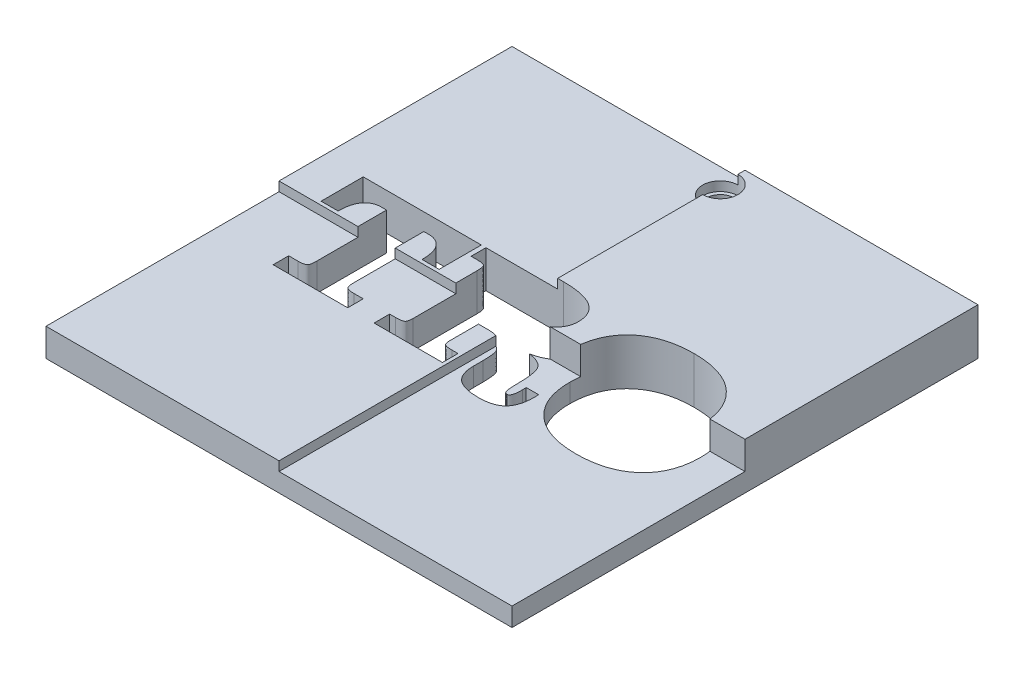
from build123d import *

# Parameters (mm, degrees)
SKETCH1_W           = 50
SKETCH1_H           = 50
BOSS_EXTRUDE1_DEPTH = 5
SKETCH2_W           = 25
SKETCH2_H           = 25
CUT_EXTRUDE1_DEPTH  = 1
SKETCH3_W           = 25
SKETCH3_H           = 25
CUT_EXTRUDE2_DEPTH  = 2
SKETCH4_W           = 25
SKETCH4_H           = 25
CUT_EXTRUDE4_DEPTH  = 3
SKETCH6_R           = 1.5
CUT_EXTRUDE5_DEPTH  = 10
CUT_EXTRUDE6_DEPTH  = 10
SKETCH12_R          = 2.504678925
CUT_EXTRUDE7_DEPTH  = 10
SKETCH13_R          = 5.546826759
CUT_EXTRUDE8_DEPTH  = 10
SKETCH14_R          = 1.891840008
CUT_EXTRUDE9_DEPTH  = 2


with BuildPart() as part:
    # Sketch1 → Boss-Extrude1 (new body)
    with BuildSketch(Plane(origin=(0, 0, 0), x_dir=(1, 0, 0), z_dir=(0, 1, 0))):
        with Locations((25, 25)):
            Rectangle(SKETCH1_W, SKETCH1_H)
    extrude(amount=BOSS_EXTRUDE1_DEPTH)

    # Sketch2 → Cut-Extrude1 (cut)
    with BuildSketch(Plane(origin=(0, 5, 0), x_dir=(1, 0, 0), z_dir=(0, 1, 0))):
        with Locations((12.5, 37.5)):
            Rectangle(SKETCH2_W, SKETCH2_H)
    extrude(amount=-CUT_EXTRUDE1_DEPTH, mode=Mode.SUBTRACT)

    # Sketch3 → Cut-Extrude2 (cut)
    with BuildSketch(Plane(origin=(0, 5, 0), x_dir=(1, 0, 0), z_dir=(0, 1, 0))):
        with Locations((12.5, 12.5)):
            Rectangle(SKETCH3_W, SKETCH3_H)
    extrude(amount=-CUT_EXTRUDE2_DEPTH, mode=Mode.SUBTRACT)

    # Sketch4 → Cut-Extrude4 (cut)
    with BuildSketch(Plane(origin=(0, 5, 0), x_dir=(1, 0, 0), z_dir=(0, 1, 0))):
        with Locations((37.5, 12.5)):
            Rectangle(SKETCH4_W, SKETCH4_H)
    extrude(amount=-CUT_EXTRUDE4_DEPTH, mode=Mode.SUBTRACT)

    # Sketch6 → Cut-Extrude5 (cut)
    with BuildSketch(Plane(origin=(0, 5, 0), x_dir=(1, 0, 0), z_dir=(0, 1, 0))):
        with Locations(Location((25, 47.351360881, 0), (0, 0, 90))):
            Circle(SKETCH6_R)
    extrude(amount=-CUT_EXTRUDE5_DEPTH, mode=Mode.SUBTRACT)

    # Sketch9 → Cut-Extrude6 (cut)
    # profile 1 of 3: a face of its own
    with BuildSketch(Plane(origin=(0, 5, 0), x_dir=(1, 0, 0), z_dir=(0, 1, 0))):
        with BuildLine():
            add(Edge.make_bspline(
                [(7.926009177, 28.067876796), (7.849493289, 28.066019227), (7.700133855, 28.062393242), (7.482963294, 28.029969051), (7.278226772, 27.980052949), (7.089668336, 27.901018046), (6.910500171, 27.810665403), (6.751708401, 27.688685531), (6.600368927, 27.554604974), (6.469080436, 27.393946058), (6.350092656, 27.215669744), (6.250231279, 27.016089882), (6.159686505, 26.799536155), (6.091326499, 26.561462976), (6.036525498, 26.305639556), (5.998211689, 26.031494308), (5.974348166, 25.738441953), (5.971665599, 25.536675618), (5.97028001, 25.432460129)],
                knots=[0, 0, 0, 0, 0.985785946, 1.924259568, 2.825360138, 3.693981063, 4.554999825, 5.403270732, 6.266685958, 7.156458516, 8.068952328, 9.024877581, 10.028602683, 11.090821908, 12.212392806, 13.399330775, 14.656713401, 16, 16, 16, 16], degree=3))
            Line((5.97028001, 25.432460129), (5.97028001, 25.377772629))
            Line((5.97028001, 25.377772629), (4.136946677, 25.377772629))
            Line((4.136946677, 25.377772629), (4.136946677, 29.901210129))
            Line((4.136946677, 29.901210129), (16.803613344, 29.901210129))
            Line((16.803613344, 29.901210129), (16.803613344, 25.377772629))
            Line((16.803613344, 25.377772629), (14.97028001, 25.377772629))
            Line((14.97028001, 25.377772629), (14.97028001, 25.432460129))
            add(Edge.make_bspline(
                [(14.97028001, 25.432460129), (14.96877781, 25.535791132), (14.965857666, 25.736657341), (14.943370935, 26.029185385), (14.90057067, 26.301865938), (14.847652837, 26.557742662), (14.773805868, 26.793003513), (14.689874248, 27.011824491), (14.583307591, 27.208632932), (14.464735013, 27.38806499), (14.331240407, 27.548944012), (14.181772906, 27.688466958), (14.016988667, 27.804554457), (13.840454501, 27.904852546), (13.646684027, 27.974332758), (13.441854388, 28.031733432), (13.221180906, 28.062058026), (13.069317629, 28.065898887), (12.991113344, 28.067876796)],
                knots=[0, 0, 0, 0, 1.326827701, 2.579234158, 3.763102493, 4.869338321, 5.930578072, 6.92615912, 7.873592171, 8.797926573, 9.684177802, 10.551727253, 11.414681905, 12.267790443, 13.149685222, 14.050052831, 14.995845303, 16, 16, 16, 16], degree=3))
            Line((12.991113344, 28.067876796), (12.47028001, 28.067876796))
            Line((12.47028001, 28.067876796), (12.47028001, 20.609543463))
            add(Edge.make_bspline(
                [(12.47028001, 20.609543463), (12.471004149, 20.504303595), (12.472308571, 20.314730502), (12.509889375, 20.063470733), (12.556775411, 19.871635109), (12.643595629, 19.731695843), (12.783509846, 19.651502619), (12.96495937, 19.605294905), (13.199097104, 19.570930421), (13.373766238, 19.568963578), (13.47028001, 19.567876796)],
                knots=[0, 0, 0, 0, 1.437268309, 2.589013121, 3.468004917, 4.126540208, 4.772106681, 5.613579557, 6.681378696, 8, 8, 8, 8], degree=3))
            Line((13.47028001, 19.567876796), (14.47028001, 19.567876796))
            Line((14.47028001, 19.567876796), (14.47028001, 17.901210129))
            Line((14.47028001, 17.901210129), (6.47028001, 17.901210129))
            Line((6.47028001, 17.901210129), (6.47028001, 19.567876796))
            Line((6.47028001, 19.567876796), (7.444238344, 19.567876796))
            add(Edge.make_bspline(
                [(7.444238344, 19.567876796), (7.539704737, 19.570169297), (7.713708763, 19.574347776), (7.94982583, 19.595948042), (8.130737337, 19.642246456), (8.254093598, 19.693688583), (8.320994565, 19.761906933), (8.362690269, 19.828264869), (8.395122947, 19.913553699), (8.424511184, 20.016117924), (8.443347686, 20.138633672), (8.458803143, 20.279369477), (8.469727086, 20.438373219), (8.470089274, 20.550496603), (8.47028001, 20.609543463)],
                knots=[0, 0, 0, 0, 1.922815781, 3.504664589, 4.750336077, 5.687799408, 6.13247731, 6.650974014, 7.254336448, 7.962191966, 8.795024655, 9.74413394, 10.812006912, 12, 12, 12, 12], degree=3))
            Line((8.47028001, 20.609543463), (8.47028001, 28.067876796))
            Line((8.47028001, 28.067876796), (7.926009177, 28.067876796))
        make_face()
    # profile 2 of 3: a face of its own
    with BuildSketch(Plane(origin=(0, 5, 0), x_dir=(1, 0, 0), z_dir=(0, 1, 0))):
        with BuildLine():
            Line((18.97028001, 20.411626796), (18.97028001, 27.294439296))
            add(Edge.make_bspline(
                [(18.97028001, 27.294439296), (18.969418817, 27.398778733), (18.967868864, 27.586566012), (18.931923098, 27.835047671), (18.881768409, 28.021565148), (18.792720138, 28.156136294), (18.649801135, 28.227146632), (18.465222003, 28.278333015), (18.219857289, 28.301516192), (18.037098031, 28.305348898), (17.936425844, 28.307460129)],
                knots=[0, 0, 0, 0, 1.416134357, 2.548720083, 3.402910744, 4.028134157, 4.667438962, 5.514761975, 6.631016828, 8, 8, 8, 8], degree=3))
            Line((17.936425844, 28.307460129), (17.303613344, 28.307460129))
            Line((17.303613344, 28.307460129), (17.303613344, 29.901210129))
            Line((17.303613344, 29.901210129), (25.621321677, 29.901210129))
            add(Edge.make_bspline(
                [(25.621321677, 29.901210129), (25.805408022, 29.899577567), (26.16089728, 29.896424926), (26.676317206, 29.861950087), (27.155596552, 29.806246725), (27.598978342, 29.725291395), (28.007060194, 29.625551716), (28.379013287, 29.500094045), (28.716260387, 29.353831696), (29.01522722, 29.179584129), (29.282480013, 28.98791575), (29.509610377, 28.766505421), (29.705057627, 28.525108021), (29.866154869, 28.259491979), (29.98812828, 27.968687741), (30.073605683, 27.655173694), (30.126730715, 27.319677557), (30.133477066, 27.088045549), (30.136946677, 26.968918463)],
                knots=[0, 0, 0, 0, 1.447358047, 2.794994048, 4.0599138, 5.239460126, 6.337079835, 7.360243329, 8.322919496, 9.222080779, 10.076742608, 10.902230611, 11.708154846, 12.513558589, 13.336361152, 14.179303263, 15.063625537, 16, 16, 16, 16], degree=3))
            add(Edge.make_bspline(
                [(30.136946677, 26.968918463), (30.135386614, 26.887168086), (30.132335147, 26.72726513), (30.095342464, 26.493244065), (30.04486392, 26.26762477), (29.970020656, 26.051182707), (29.868045166, 25.847395908), (29.752132408, 25.649847033), (29.609656615, 25.465393137), (29.448655934, 25.289775044), (29.264491251, 25.130192953), (29.067202967, 24.976277681), (28.847080527, 24.842975596), (28.611689577, 24.719650187), (28.358788033, 24.609623249), (28.086089003, 24.517899528), (27.797602704, 24.43223756), (27.596518438, 24.391027881), (27.49371751, 24.369960129)],
                knots=[0, 0, 0, 0, 0.967140512, 1.891717614, 2.799339141, 3.703110595, 4.594995222, 5.494077817, 6.411023377, 7.349383543, 8.310606086, 9.293353638, 10.308886033, 11.352589539, 12.439149687, 13.570447126, 14.757932207, 16, 16, 16, 16], degree=3))
            add(Edge.make_bspline(
                [(27.49371751, 24.369960129), (27.594651975, 24.35576073), (27.789035856, 24.328414923), (28.066041701, 24.26598397), (28.316499691, 24.187637992), (28.543846728, 24.097671383), (28.743939492, 23.987802835), (28.921171325, 23.865649117), (29.071436508, 23.72642993), (29.199308648, 23.566716017), (29.307601258, 23.37212609), (29.395705872, 23.131194367), (29.469646331, 22.83946946), (29.530655731, 22.497348243), (29.579817963, 22.103637552), (29.611457291, 21.658576626), (29.632587796, 21.161829821), (29.635444226, 20.813561878), (29.636946677, 20.630376796)],
                knots=[0, 0, 0, 0, 0.991130308, 1.908760865, 2.757961986, 3.541905859, 4.282455225, 4.973456294, 5.630615782, 6.267502631, 6.955557208, 7.786642557, 8.755293022, 9.87975877, 11.164732285, 12.612682602, 14.218308551, 16, 16, 16, 16], degree=3))
            add(Edge.make_bspline(
                [(29.636946677, 20.630376796), (29.637471229, 20.523569244), (29.638435994, 20.327126757), (29.656544644, 20.059359802), (29.682703885, 19.843769446), (29.721743268, 19.676766267), (29.779267444, 19.553268011), (29.853291775, 19.46606476), (29.945307585, 19.408161115), (30.01548214, 19.403546404), (30.051009177, 19.401210129)],
                knots=[0, 0, 0, 0, 1.808687603, 3.326572724, 4.543004545, 5.484445255, 6.220909007, 6.825336762, 7.405307179, 8, 8, 8, 8], degree=3))
            add(Edge.make_bspline(
                [(30.051009177, 19.401210129), (30.085052379, 19.40429116), (30.154535258, 19.410579608), (30.243915734, 19.480026489), (30.318405566, 19.580288478), (30.372310484, 19.721148506), (30.420096508, 19.896936248), (30.446931358, 20.114170166), (30.469625498, 20.369472939), (30.470051958, 20.55304404), (30.47028001, 20.651210129)],
                knots=[0, 0, 0, 0, 0.565824228, 1.154858948, 1.834334212, 2.661153868, 3.677074, 4.90514067, 6.344999642, 8, 8, 8, 8], degree=3))
            add(Edge.make_bspline(
                [(30.47028001, 20.651210129), (30.470589354, 20.678995028), (30.4713438, 20.746758451), (30.463646664, 20.856003039), (30.463240678, 20.967202496), (30.46085334, 21.038366182), (30.459863344, 21.067876796)],
                knots=[0, 0, 0, 0, 0.799657267, 1.950250566, 3.149996744, 4, 4, 4, 4], degree=3))
            Line((30.459863344, 21.067876796), (31.785384177, 21.067876796))
            add(Edge.make_bspline(
                [(31.785384177, 21.067876796), (31.786233795, 21.03662695), (31.788311073, 20.960222482), (31.79211608, 20.839483595), (31.801576712, 20.71815024), (31.803010836, 20.641673202), (31.803613344, 20.609543463)],
                knots=[0, 0, 0, 0, 0.817781838, 1.999439847, 3.159519278, 4, 4, 4, 4], degree=3))
            add(Edge.make_bspline(
                [(31.803613344, 20.609543463), (31.802012512, 20.480981813), (31.798912951, 20.23205834), (31.76392328, 19.872815293), (31.710989786, 19.539783602), (31.632965802, 19.234800742), (31.534594521, 18.95705292), (31.414554461, 18.706427735), (31.270558358, 18.482955806), (31.102630594, 18.285646004), (30.909786638, 18.113920131), (30.690725953, 17.967887899), (30.44670313, 17.841561999), (30.17442149, 17.740981011), (29.874948943, 17.663607675), (29.549334355, 17.606806936), (29.196700381, 17.572795265), (28.952996791, 17.569552603), (28.827050844, 17.567876796)],
                knots=[0, 0, 0, 0, 1.25121693, 2.422629631, 3.510491092, 4.531254515, 5.482892928, 6.374912584, 7.230519467, 8.063755052, 8.889802427, 9.735966395, 10.620427789, 11.559106827, 12.555331378, 13.627953199, 14.774126871, 16, 16, 16, 16], degree=3))
            add(Edge.make_bspline(
                [(28.827050844, 17.567876796), (28.692452823, 17.569953361), (28.433351878, 17.573950746), (28.058419938, 17.602246573), (27.711997763, 17.650869693), (27.392833734, 17.72005173), (27.102409424, 17.812296501), (26.837880564, 17.918955179), (26.604346962, 18.051767908), (26.394677418, 18.199056392), (26.216022846, 18.375501321), (26.058850259, 18.570318428), (25.926975329, 18.790382477), (25.820754268, 19.033986906), (25.737826831, 19.301318216), (25.677768905, 19.591625858), (25.645282297, 19.905681793), (25.639786778, 20.122494172), (25.636946677, 20.234543463)],
                knots=[0, 0, 0, 0, 1.346481936, 2.591975286, 3.758685152, 4.843779364, 5.854496905, 6.804402878, 7.690903338, 8.536878035, 9.359807164, 10.193886679, 11.035347571, 11.91796892, 12.846313878, 13.830723457, 14.87891135, 16, 16, 16, 16], degree=3))
            Line((25.636946677, 20.234543463), (25.636946677, 21.276210129))
            add(Edge.make_bspline(
                [(25.636946677, 21.276210129), (25.635635201, 21.3855789), (25.63313616, 21.593983023), (25.622970697, 21.891433859), (25.59377119, 22.157565649), (25.567495065, 22.393447153), (25.521028395, 22.596481057), (25.47128434, 22.769219213), (25.409904801, 22.912261006), (25.334418043, 23.026543409), (25.244580148, 23.119647453), (25.134845899, 23.194958613), (25.006463014, 23.26064762), (24.85604783, 23.311196987), (24.686379764, 23.353441293), (24.496099669, 23.379940448), (24.285791899, 23.399522068), (24.138737914, 23.400628457), (24.061425844, 23.401210129)],
                knots=[0, 0, 0, 0, 1.659603876, 3.16240448, 4.512164462, 5.720991446, 6.759486782, 7.667725714, 8.44597066, 9.110752127, 9.734756113, 10.39613714, 11.120595875, 11.91614339, 12.797733406, 13.769982266, 14.827591855, 16, 16, 16, 16], degree=3))
            Line((24.061425844, 23.401210129), (23.004134177, 23.401210129))
            Line((23.004134177, 23.401210129), (23.004134177, 20.411626796))
            add(Edge.make_bspline(
                [(23.004134177, 20.411626796), (23.005436852, 20.325562261), (23.007792156, 20.169953058), (23.039438037, 19.963246904), (23.090696999, 19.807528109), (23.173402271, 19.693144651), (23.30735909, 19.632804629), (23.480369876, 19.595896102), (23.706603164, 19.570159944), (23.874728909, 19.568689641), (23.967675844, 19.567876796)],
                knots=[0, 0, 0, 0, 1.32531531, 2.39623976, 3.208776491, 3.837595926, 4.501703267, 5.41009771, 6.568193834, 8, 8, 8, 8], degree=3))
            Line((23.967675844, 19.567876796), (24.636946677, 19.567876796))
            Line((24.636946677, 19.567876796), (24.636946677, 17.901210129))
            Line((24.636946677, 17.901210129), (17.303613344, 17.901210129))
            Line((17.303613344, 17.901210129), (17.303613344, 19.567876796))
            Line((17.303613344, 19.567876796), (17.936425844, 19.567876796))
            add(Edge.make_bspline(
                [(17.936425844, 19.567876796), (18.036310685, 19.568743977), (18.217409962, 19.570316247), (18.46008061, 19.595456765), (18.645197438, 19.632767981), (18.786620808, 19.692805095), (18.879520222, 19.804992436), (18.932087182, 19.96333475), (18.967607844, 20.169565387), (18.969328978, 20.325476361), (18.97028001, 20.411626796)],
                knots=[0, 0, 0, 0, 1.479520387, 2.682489834, 3.605979081, 4.278943512, 4.908082701, 5.693868876, 6.725720242, 8, 8, 8, 8], degree=3))
        make_face()
        with BuildLine():
            Line((22.97028001, 25.067876796), (24.00153001, 25.067876796))
            add(Edge.make_bspline(
                [(24.00153001, 25.067876796), (24.088351803, 25.068885329), (24.256069553, 25.070833559), (24.497923941, 25.085404397), (24.719590308, 25.114299739), (24.920752055, 25.152571176), (25.101972063, 25.202049874), (25.263587394, 25.261249475), (25.406572557, 25.330718676), (25.528483246, 25.41615047), (25.634200505, 25.512984572), (25.723670502, 25.625503708), (25.802774461, 25.750253154), (25.865220999, 25.892563391), (25.910913191, 26.049560763), (25.944812524, 26.220342413), (25.965533878, 26.405049035), (25.968665345, 26.533100265), (25.97028001, 26.599126796)],
                knots=[0, 0, 0, 0, 1.438960556, 2.779707943, 4.012777313, 5.141379257, 6.17101079, 7.122385903, 7.990967882, 8.797138326, 9.581050026, 10.358466024, 11.172810776, 12.022967835, 12.924178966, 13.877835688, 14.90575712, 16, 16, 16, 16], degree=3))
            add(Edge.make_bspline(
                [(25.97028001, 26.599126796), (25.969896003, 26.672116711), (25.969158193, 26.812355132), (25.946534248, 27.013120216), (25.916744831, 27.197209815), (25.872335769, 27.364645225), (25.816289924, 27.51650171), (25.744413855, 27.650023813), (25.664870268, 27.770196778), (25.565332676, 27.870506185), (25.451148206, 27.957495036), (25.319659027, 28.034254287), (25.16720781, 28.094903476), (24.997678156, 28.147699564), (24.808168321, 28.185609779), (24.599427518, 28.213686176), (24.370794046, 28.232549429), (24.211639095, 28.233862681), (24.129134177, 28.234543463)],
                knots=[0, 0, 0, 0, 1.215008857, 2.334444762, 3.361431019, 4.318981971, 5.215986478, 6.050434347, 6.840607, 7.607548007, 8.39134391, 9.22716886, 10.134833056, 11.118239301, 12.181734623, 13.349442456, 14.62596777, 16, 16, 16, 16], degree=3))
            Line((24.129134177, 28.234543463), (22.97028001, 28.234543463))
            Line((22.97028001, 28.234543463), (22.97028001, 25.067876796))
        make_face(mode=Mode.SUBTRACT)
    # profile 3 of 3: a face of its own
    with BuildSketch(Plane(origin=(0, 5, 0), x_dir=(1, 0, 0), z_dir=(0, 1, 0))):
        with BuildLine():
            add(Edge.make_bspline(
                [(32.303613344, 23.893397629), (32.308593508, 24.134143147), (32.318319909, 24.604325946), (32.409215543, 25.288674614), (32.553794533, 25.933562891), (32.757636584, 26.538588021), (33.017701658, 27.105217673), (33.341355783, 27.629237668), (33.721343019, 28.114819343), (34.159533746, 28.55741074), (34.649751672, 28.952126877), (35.184199587, 29.299679085), (35.766335949, 29.588139269), (36.391098052, 29.825002092), (37.059751486, 30.010165966), (37.772398998, 30.141783148), (38.530137447, 30.220431468), (39.049949452, 30.229758378), (39.316634177, 30.234543463)],
                knots=[0, 0, 0, 0, 1.078088748, 2.105537783, 3.086695004, 4.034873809, 4.960542409, 5.873651433, 6.787761977, 7.717245901, 8.657439748, 9.602383052, 10.567634715, 11.562188082, 12.591593002, 13.671643952, 14.805458539, 16, 16, 16, 16], degree=3))
            add(Edge.make_bspline(
                [(39.316634177, 30.234543463), (39.581575915, 30.229704502), (40.098774221, 30.220258267), (40.852292928, 30.142191188), (41.562033918, 30.009277543), (42.227803072, 29.82608757), (42.849440009, 29.587550795), (43.428701132, 29.29896253), (43.962401406, 28.952897656), (44.450450727, 28.557362981), (44.885844695, 28.113979664), (45.266159769, 27.62941974), (45.5889695, 27.104530665), (45.852651061, 26.539260442), (46.056625393, 25.933836427), (46.197153894, 25.288301233), (46.289144647, 24.604375443), (46.29871373, 24.134159909), (46.303613344, 23.893397629)],
                knots=[0, 0, 0, 0, 1.18936902, 2.321792135, 3.396549041, 4.428210346, 5.417662824, 6.381545819, 7.328560373, 8.267787463, 9.196573312, 10.112687524, 11.02779802, 11.957139773, 12.907396921, 13.889847023, 14.919548156, 16, 16, 16, 16], degree=3))
            add(Edge.make_bspline(
                [(46.303613344, 23.893397629), (46.298627226, 23.652654929), (46.288889197, 23.182477635), (46.198076392, 22.498089759), (46.053202678, 21.853340992), (45.850291359, 21.247472184), (45.58623727, 20.68232043), (45.264183625, 20.157798537), (44.883164295, 19.674461426), (44.445102442, 19.235513937), (43.956854124, 18.840788378), (43.42067166, 18.498089354), (42.838275272, 18.212964381), (42.21452924, 17.972330221), (41.543225711, 17.794143288), (40.829751513, 17.660172492), (40.070980607, 17.582023507), (39.550321751, 17.572678664), (39.28278001, 17.567876796)],
                knots=[0, 0, 0, 0, 1.07832422, 2.105997667, 3.087369188, 4.035755091, 4.963266786, 5.876575248, 6.787827117, 7.714751356, 8.649680306, 9.595997909, 10.559727106, 11.550863454, 12.586960805, 13.667247655, 14.801309886, 16, 16, 16, 16], degree=3))
            add(Edge.make_bspline(
                [(39.28278001, 17.567876796), (39.0177754, 17.572215175), (38.502090043, 17.580657437), (37.751215181, 17.665236203), (37.042893127, 17.791406733), (36.378304994, 17.978091798), (35.755409724, 18.21257857), (35.179643305, 18.507935211), (34.643893215, 18.848844244), (34.156824388, 19.245230637), (33.722218449, 19.688215324), (33.340433515, 20.170701596), (33.018254033, 20.694090102), (32.758496129, 21.25908334), (32.549131315, 21.860840795), (32.410989353, 22.504773378), (32.317767315, 23.185813699), (32.308412446, 23.653481401), (32.303613344, 23.893397629)],
                knots=[0, 0, 0, 0, 1.191924326, 2.319423498, 3.395773947, 4.425889541, 5.421115098, 6.385345938, 7.332278931, 8.273523908, 9.204305212, 10.119316704, 11.036393274, 11.962541017, 12.912401614, 13.896962466, 14.921129616, 16, 16, 16, 16], degree=3))
        make_face()
        with BuildLine():
            add(Edge.make_bspline(
                [(39.311425844, 28.401210129), (39.212227211, 28.398688376), (39.020305949, 28.393809497), (38.742759571, 28.342402844), (38.485839623, 28.260642482), (38.251097342, 28.140360244), (38.035045553, 27.991353922), (37.840480464, 27.807265482), (37.670982431, 27.586813295), (37.518291698, 27.335032812), (37.389715756, 27.044321332), (37.274161229, 26.718418195), (37.182800754, 26.350736145), (37.105202006, 25.943823985), (37.043159711, 25.496236939), (37.00001491, 25.008691914), (36.973728955, 24.481364742), (36.971458068, 24.116520489), (36.97028001, 23.927251796)],
                knots=[0, 0, 0, 0, 0.837293503, 1.619925816, 2.376058408, 3.10752823, 3.839990224, 4.587104727, 5.360332387, 6.18297747, 7.06921189, 8.041168341, 9.101407317, 10.266558941, 11.540319666, 12.917532377, 14.400921449, 16, 16, 16, 16], degree=3))
            add(Edge.make_bspline(
                [(36.97028001, 23.927251796), (36.971490303, 23.734514592), (36.973824878, 23.362736901), (36.999688639, 22.825825909), (37.043906985, 22.330707653), (37.102234326, 21.876745053), (37.179113542, 21.464169255), (37.276032947, 21.093021659), (37.384966328, 20.761342007), (37.516600157, 20.470979631), (37.665217956, 20.217358314), (37.835373328, 19.99861849), (38.028130307, 19.813231456), (38.241359003, 19.662049812), (38.476086102, 19.544882928), (38.730686353, 19.462823748), (39.006148434, 19.407986671), (39.197432825, 19.403511491), (39.295800844, 19.401210129)],
                knots=[0, 0, 0, 0, 1.617460665, 3.119977775, 4.509694113, 5.788344191, 6.95997005, 8.029008616, 9.005822425, 9.886095728, 10.699464032, 11.467490697, 12.204304397, 12.93602223, 13.652790516, 14.396915192, 15.175613457, 16, 16, 16, 16], degree=3))
            add(Edge.make_bspline(
                [(39.295800844, 19.401210129), (39.394982476, 19.403812798), (39.587725902, 19.408870662), (39.866331496, 19.459518836), (40.124527467, 19.54246358), (40.360822286, 19.661300964), (40.576518173, 19.810312907), (40.769903414, 19.994306898), (40.941445899, 20.210915432), (41.090669999, 20.463092393), (41.221713629, 20.750186728), (41.331798478, 21.078037292), (41.42768803, 21.445149601), (41.505131595, 21.853252573), (41.5631414, 22.301203671), (41.607598644, 22.789349009), (41.633396773, 23.318463705), (41.635734269, 23.6850356), (41.636946677, 23.875168463)],
                knots=[0, 0, 0, 0, 0.836697002, 1.625985013, 2.381578925, 3.119075815, 3.851015992, 4.587237092, 5.364454299, 6.176453752, 7.055389686, 8.024244816, 9.092665149, 10.256986701, 11.528847815, 12.905079378, 14.394732044, 16, 16, 16, 16], degree=3))
            add(Edge.make_bspline(
                [(41.636946677, 23.875168463), (41.6357258, 24.066169639), (41.63336604, 24.435344246), (41.60753197, 24.968784041), (41.56337292, 25.461309318), (41.504758773, 25.913493091), (41.428103249, 26.325220602), (41.331286104, 26.696417203), (41.22169854, 27.028679453), (41.090655142, 27.32095621), (40.942025545, 27.577158952), (40.771869867, 27.798423023), (40.580213034, 27.985816367), (40.366905635, 28.138704087), (40.132359229, 28.257413974), (39.876510163, 28.339530035), (39.601086466, 28.394451681), (39.409796652, 28.398914912), (39.311425844, 28.401210129)],
                knots=[0, 0, 0, 0, 1.603769513, 3.099828973, 4.48304642, 5.755170838, 6.927438389, 7.99706246, 8.974411264, 9.861807641, 10.681897503, 11.456096666, 12.198377549, 12.924557335, 13.651504965, 14.396037193, 15.175161946, 16, 16, 16, 16], degree=3))
        make_face(mode=Mode.SUBTRACT)
    extrude(amount=-CUT_EXTRUDE6_DEPTH, mode=Mode.SUBTRACT)


with BuildPart() as cut_extrude6_piece_1:
    # of the separate pieces the step leaves, piece 1, a body of its own (cut_extrude6_pieces)
    add(part.part.solids().sort_by_distance((0, 0, 0))[0])

    # Sketch14 → Cut-Extrude9 (cut)
    with BuildSketch(Plane(origin=(0, 5, 0), x_dir=(1, 0, 0), z_dir=(0, 1, 0))):
        with Locations(Location((25, 47.351360881, 0), (0, 0, 270))):
            Circle(SKETCH14_R)
    extrude(amount=-CUT_EXTRUDE9_DEPTH, mode=Mode.SUBTRACT)


with BuildPart() as cut_extrude6_piece_2:
    # of the separate pieces the step leaves, piece 2, a body of its own (cut_extrude6_pieces)
    add(part.part.solids().sort_by_distance((36.97028001, 0, -23.927251796))[0])

    # Sketch13 → Cut-Extrude8 (cut)
    with BuildSketch(Plane(origin=(0, 5, 0), x_dir=(1, 0, 0), z_dir=(0, 1, 0))):
        with Locations((39.264235045, 23.900187485)):
            Circle(SKETCH13_R)
    extrude(amount=-CUT_EXTRUDE8_DEPTH, mode=Mode.SUBTRACT)


with BuildPart() as cut_extrude6_piece_3:
    # of the separate pieces the step leaves, piece 3, a body of its own (cut_extrude6_pieces)
    add(part.part.solids().sort_by_distance((22.97028001, 0, -28.234543463))[0])

    # Sketch12 → Cut-Extrude7 (cut)
    with BuildSketch(Plane(origin=(0, 5, 0), x_dir=(1, 0, 0), z_dir=(0, 1, 0))):
        with Locations((23.933515137, 26.899676163)):
            Circle(SKETCH12_R)
    extrude(amount=-CUT_EXTRUDE7_DEPTH, mode=Mode.SUBTRACT)


solid = cut_extrude6_piece_1.part
